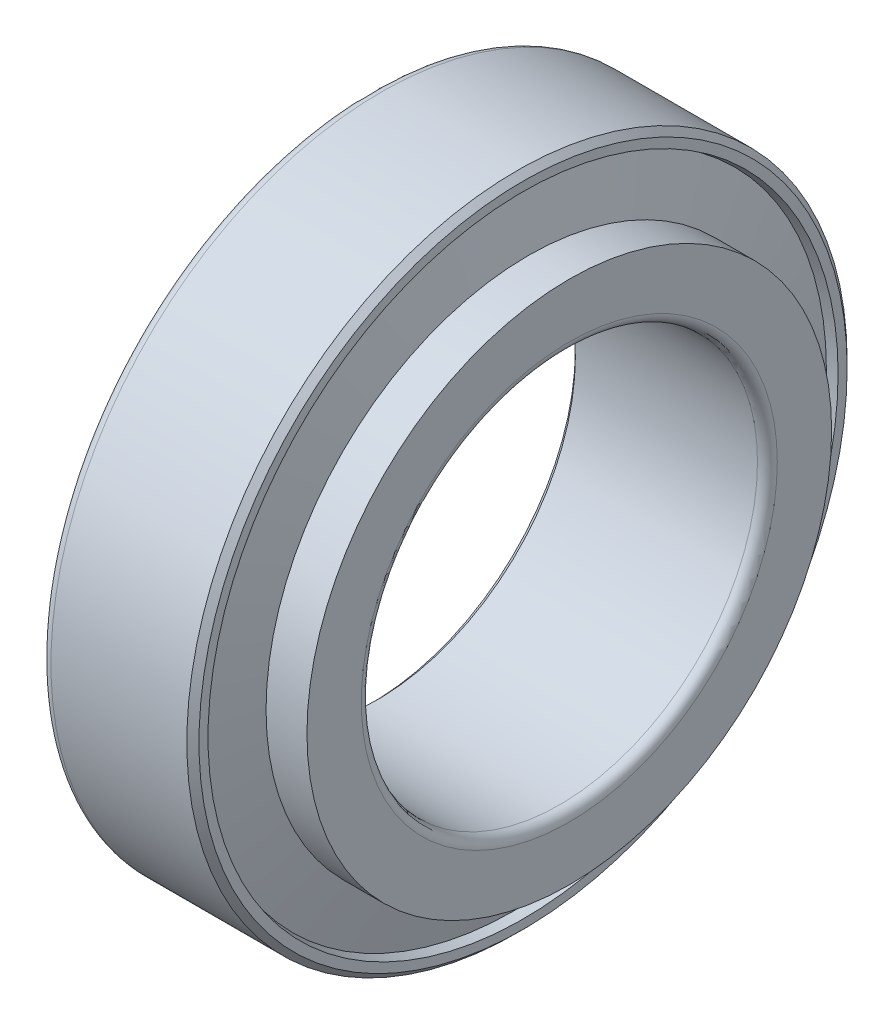
from build123d import *


with BuildPart() as part:
    # OutRacSke → OuterRace (revolve)
    with BuildSketch(Plane.XY):
        with BuildLine():
            Line((-7, 47.70970444), (-30, 41.7615))
            Line((-30, 41.7615), (-30, 48.5))
            ThreePointArc((-30, 48.5), (-29.560660172, 49.560660172), (-28.5, 50))
            Line((-28.5, 50), (-7.92, 50))
            Line((-7.92, 50), (-7, 49.08))
            Line((-7, 49.08), (-7, 47.70970444))
        make_face()
    revolve(axis=Axis((-42.5, 0, 0), (1, 0, 0)))

    # RolSimSke → RollersSimplified (revolve)
    with BuildSketch(Plane.XY):
        Polygon((-28.5, 42.360173508), (-8.459343844, 47.543039592), (-6.205923808, 38.829710828), (-26.246579964, 33.646844745), align=None)
    revolve(axis=Axis((0, 0, 0), (-1, 0, 0)))

    # InsRacSke → InnerRace (revolve)
    with BuildSketch(Plane.XY):
        with BuildLine():
            Line((-26.351690779, 34.096844744), (-30, 34.096844744))
            Line((-30, 34.096844744), (-30, 30.92))
            Line((-30, 30.92), (-29.08, 30))
            Line((-29.08, 30), (-1.5, 30))
            ThreePointArc((-1.5, 30), (-0.439339828, 30.439339828), (0, 31.5))
            Line((0, 31.5), (0, 39.729710828))
            Line((0, 39.729710828), (-6.19465671, 39.729710828))
            Line((-6.19465671, 39.729710828), (-6.19465671, 38.829710828))
            Line((-6.19465671, 38.829710828), (-26.235312866, 33.646844744))
            Line((-26.235312866, 33.646844744), (-26.351690779, 34.096844744))
        make_face()
    revolve(axis=Axis((-42.5, 0, 0), (1, 0, 0)))


solid = part.part
